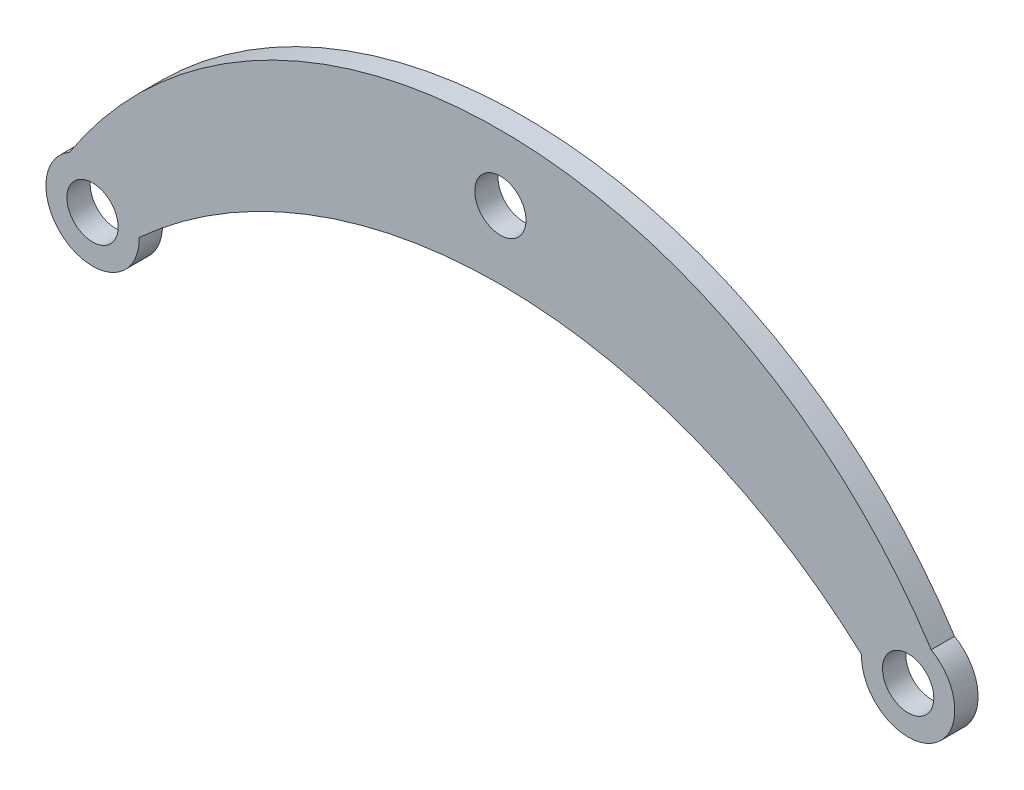
from build123d import *

# Parameters (mm, degrees)
SKETCH1_R           = 11
BOSS_EXTRUDE1_DEPTH = 10
SKETCH3_R           = 11
CUT_EXTRUDE1_DEPTH  = 10


with BuildPart() as part:
    # Sketch1 → Boss-Extrude1 (new body)
    with BuildSketch(Plane.XY):
        with BuildLine():
            ThreePointArc((-9.87804878, 17.390346526), (-9.770615429, -17.450933332), (19.9888361, 0.668155187))
            ThreePointArc((19.9888361, 0.668155187), (175, 60.751884434), (330.0111639, 0.668155187))
            ThreePointArc((330.0111639, 0.668155187), (359.770615429, -17.450933332), (359.87804878, 17.390346526))
            ThreePointArc((359.87804878, 17.390346526), (175, 118.142256063), (-9.87804878, 17.390346526))
        make_face()
        Circle(SKETCH1_R, mode=Mode.SUBTRACT)
        with Locations((350, 0)):
            Circle(SKETCH1_R, mode=Mode.SUBTRACT)
    extrude(amount=BOSS_EXTRUDE1_DEPTH)

    # Sketch3 → Cut-Extrude1 (cut)
    with BuildSketch(Plane.XY.offset(10)):
        with Locations((175, 90)):
            Circle(SKETCH3_R)
    extrude(amount=-CUT_EXTRUDE1_DEPTH, mode=Mode.SUBTRACT)


solid = part.part
